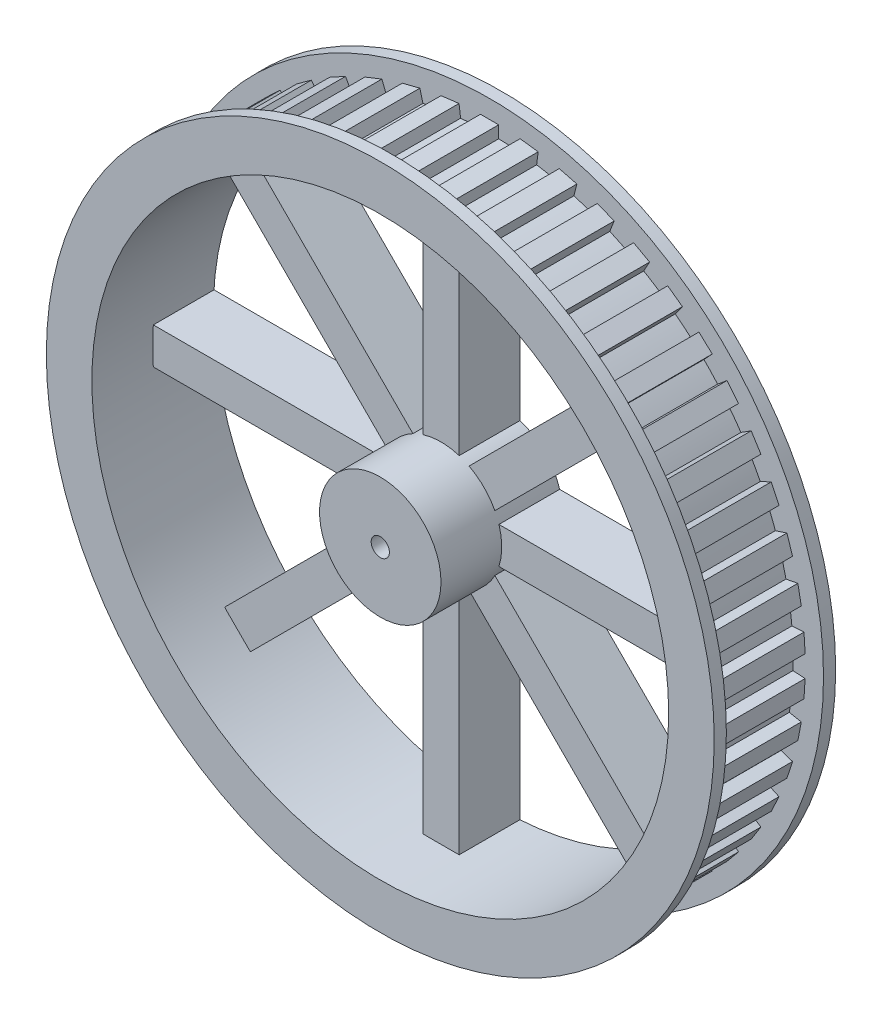
from build123d import *

# Parameters (mm, degrees)
SKETCH1_R               = 10
BOSS_EXTRUDE1_DEPTH     = 20
SKETCH2_R               = 55
SKETCH2_R_2             = 47.5
BOSS_EXTRUDE2_DEPTH     = 2
SKETCH3_R               = 50
SKETCH3_R_2             = 47.5
SKETCH3_W               = 3
SKETCH3_H               = 2
BOSS_EXTRUDE3_DEPTH     = 20
SKETCH4_R               = 55
SKETCH4_R_2             = 47.5
BOSS_EXTRUDE4_DEPTH     = 2
CUT_EXTRUDE2_DEPTH      = 30
CUT_EXTRUDE2_DEPTH_BACK = 81.311892021
SKETCH5_R               = 1.5
SKETCH6_W               = 6
SKETCH6_H               = 37.865776481
BOSS_EXTRUDE6_DEPTH     = 10
CIRPATTERN1_COUNT       = 8


with BuildPart() as part:
    # Sketch1 → Boss-Extrude1 (new body)
    with BuildSketch(Plane.XY):
        Circle(SKETCH1_R)
    extrude(amount=BOSS_EXTRUDE1_DEPTH)

    # Sketch5 → Cut-Extrude2 (cut, two sides: drawn at the far end of the back side and taken through both)
    with BuildSketch(Plane.XY.offset(-CUT_EXTRUDE2_DEPTH_BACK)):
        Circle(SKETCH5_R)
    extrude(amount=CUT_EXTRUDE2_DEPTH + CUT_EXTRUDE2_DEPTH_BACK, mode=Mode.SUBTRACT)

    # Sketch6 → Boss-Extrude6 (add)
    with BuildSketch(Plane.XY):
        with Locations((0, 28.472280255)):
            Rectangle(SKETCH6_W, SKETCH6_H)
    boss_extrude6 = extrude(amount=BOSS_EXTRUDE6_DEPTH)

    # CirPattern1: Boss-Extrude6 ×8 about axis
    cirpattern1_axis = Axis((0, 0, 0), (0, 0, 1))
    for i in range(1, CIRPATTERN1_COUNT):
        add(boss_extrude6.rotate(cirpattern1_axis, i * 360 / CIRPATTERN1_COUNT))


with BuildPart() as body_2:
    # Sketch2 → Boss-Extrude2 (new body)
    with BuildSketch(Plane.XY):
        Circle(SKETCH2_R)
        Circle(SKETCH2_R_2, mode=Mode.SUBTRACT)
    extrude(amount=BOSS_EXTRUDE2_DEPTH)

    # Sketch3 → Boss-Extrude3 (add)
    # profile 1 of 51: a face of its own
    with BuildSketch(Plane.XY):
        Circle(SKETCH3_R)
        Circle(SKETCH3_R_2, mode=Mode.SUBTRACT)
    # profile 2 of 51: a face of its own
    with BuildSketch(Plane.XY):
        with Locations((0, 50.977494935)):
            Rectangle(SKETCH3_W, SKETCH3_H)
    # profile 3 of 51: a face of its own
    with BuildSketch(Plane.XY):
        Polygon((4.775668994, 49.77140731), (5.026335461, 51.755636713), (8.002679565, 51.379637012), (7.752013098, 49.39540761), align=None)
    # profile 4 of 51: a face of its own
    with BuildSketch(Plane.XY):
        Polygon((10.976022835, 48.78039486), (11.473402609, 50.717561183), (14.379152092, 49.971491521), (13.881772318, 48.034325199), align=None)
    # profile 5 of 51: a face of its own
    with BuildSketch(Plane.XY):
        Polygon((17.003278238, 47.020086443), (17.739527344, 48.879639415), (20.528856802, 47.775265757), (19.792607696, 45.915712785), align=None)
    # profile 6 of 51: a face of its own
    with BuildSketch(Plane.XY):
        Polygon((22.762381787, 44.518243175), (23.725889136, 46.270856535), (26.354809176, 44.825595513), (25.391301828, 43.072982152), align=None)
    # profile 7 of 51: a face of its own
    with BuildSketch(Plane.XY):
        Polygon((28.162508978, 41.314320617), (29.338079482, 42.932354606), (31.765130466, 41.168998849), (30.589559961, 39.55096486), align=None)
    # profile 8 of 51: a face of its own
    with BuildSketch(Plane.XY):
        Polygon((33.118496578, 37.458846544), (34.48759079, 38.916783799), (36.674496672, 36.863142481), (35.305402461, 35.405205226), align=None)
    # profile 9 of 51: a face of its own
    with BuildSketch(Plane.XY):
        Polygon((37.552185704, 33.012624083), (39.093212189, 34.287472063), (41.005484159, 31.975932335), (39.464457673, 30.701084355), align=None)
    # profile 10 of 51: a face of its own
    with BuildSketch(Plane.XY):
        Polygon((41.393654428, 28.04577282), (43.082310279, 29.11742641), (44.689790664, 26.584442634), (43.001134813, 25.512789044), align=None)
    # profile 11 of 51: a face of its own
    with BuildSketch(Plane.XY):
        Polygon((44.582320495, 22.636622966), (46.391974599, 23.48818155), (47.669312474, 20.773700392), (45.859658369, 19.922141809), align=None)
    # profile 12 of 51: a face of its own
    with BuildSketch(Plane.XY):
        Polygon((47.067896735, 16.870480046), (48.970009767, 17.488514034), (49.89706075, 14.635344486), (47.994947718, 14.017310497), align=None)
    # profile 13 of 51: a face of its own
    with BuildSketch(Plane.XY):
        Polygon((48.811184126, 10.838279577), (50.775758628, 11.213042206), (51.337902572, 8.266180454), (49.37332807, 7.891417825), align=None)
    # profile 14 of 51: a face of its own
    with BuildSketch(Plane.XY):
        Polygon((49.784689986, 4.635152964), (51.780743443, 4.760734003), (51.969115001, 1.766653818), (49.973061545, 1.641072779), align=None)
    # profile 15 of 51: a face of its own
    with BuildSketch(Plane.XY):
        Polygon((49.973061545, -1.641072779), (51.969115001, -1.766653818), (51.780743443, -4.760734003), (49.784689986, -4.635152964), align=None)
    # profile 16 of 51: a face of its own
    with BuildSketch(Plane.XY):
        Polygon((49.37332807, -7.891417825), (51.337902572, -8.266180454), (50.775758628, -11.213042206), (48.811184126, -10.838279577), align=None)
    # profile 17 of 51: a face of its own
    with BuildSketch(Plane.XY):
        Polygon((47.994947718, -14.017310497), (49.89706075, -14.635344486), (48.970009767, -17.488514034), (47.067896735, -16.870480046), align=None)
    # profile 18 of 51: a face of its own
    with BuildSketch(Plane.XY):
        Polygon((45.859658369, -19.922141809), (47.669312474, -20.773700392), (46.391974599, -23.48818155), (44.582320495, -22.636622966), align=None)
    # profile 19 of 51: a face of its own
    with BuildSketch(Plane.XY):
        Polygon((43.001134813, -25.512789044), (44.689790664, -26.584442634), (43.082310279, -29.11742641), (41.393654428, -28.04577282), align=None)
    # profile 20 of 51: a face of its own
    with BuildSketch(Plane.XY):
        Polygon((39.464457673, -30.701084355), (41.005484159, -31.975932335), (39.093212189, -34.287472063), (37.552185704, -33.012624083), align=None)
    # profile 21 of 51: a face of its own
    with BuildSketch(Plane.XY):
        Polygon((35.305402461, -35.405205226), (36.674496672, -36.863142481), (34.48759079, -38.916783799), (33.118496578, -37.458846544), align=None)
    # profile 22 of 51: a face of its own
    with BuildSketch(Plane.XY):
        Polygon((30.589559961, -39.55096486), (31.765130466, -41.168998849), (29.338079482, -42.932354606), (28.162508978, -41.314320617), align=None)
    # profile 23 of 51: a face of its own
    with BuildSketch(Plane.XY):
        Polygon((25.391301828, -43.072982152), (26.354809176, -44.825595513), (23.725889136, -46.270856535), (22.762381787, -44.518243175), align=None)
    # profile 24 of 51: a face of its own
    with BuildSketch(Plane.XY):
        Polygon((19.792607696, -45.915712785), (20.528856802, -47.775265757), (17.739527344, -48.879639415), (17.003278238, -47.020086443), align=None)
    # profile 25 of 51: a face of its own
    with BuildSketch(Plane.XY):
        Polygon((13.881772318, -48.034325199), (14.379152092, -49.971491521), (11.473402609, -50.717561183), (10.976022835, -48.78039486), align=None)
    # profile 26 of 51: a face of its own
    with BuildSketch(Plane.XY):
        Polygon((7.752013098, -49.39540761), (8.002679565, -51.379637012), (5.026335461, -51.755636713), (4.775668994, -49.77140731), align=None)
    # profile 27 of 51: a face of its own
    with BuildSketch(Plane.XY):
        with Locations((0, -50.977494935)):
            Rectangle(SKETCH3_W, SKETCH3_H)
    # profile 28 of 51: a face of its own
    with BuildSketch(Plane.XY):
        Polygon((-4.775668994, -49.77140731), (-5.026335461, -51.755636713), (-8.002679565, -51.379637012), (-7.752013098, -49.39540761), align=None)
    # profile 29 of 51: a face of its own
    with BuildSketch(Plane.XY):
        Polygon((-10.976022835, -48.78039486), (-11.473402609, -50.717561183), (-14.379152092, -49.971491521), (-13.881772318, -48.034325199), align=None)
    # profile 30 of 51: a face of its own
    with BuildSketch(Plane.XY):
        Polygon((-17.003278238, -47.020086443), (-17.739527344, -48.879639415), (-20.528856802, -47.775265757), (-19.792607696, -45.915712785), align=None)
    # profile 31 of 51: a face of its own
    with BuildSketch(Plane.XY):
        Polygon((-22.762381787, -44.518243175), (-23.725889136, -46.270856535), (-26.354809176, -44.825595513), (-25.391301828, -43.072982152), align=None)
    # profile 32 of 51: a face of its own
    with BuildSketch(Plane.XY):
        Polygon((-28.162508978, -41.314320617), (-29.338079482, -42.932354606), (-31.765130466, -41.168998849), (-30.589559961, -39.55096486), align=None)
    # profile 33 of 51: a face of its own
    with BuildSketch(Plane.XY):
        Polygon((-33.118496578, -37.458846544), (-34.48759079, -38.916783799), (-36.674496672, -36.863142481), (-35.305402461, -35.405205226), align=None)
    # profile 34 of 51: a face of its own
    with BuildSketch(Plane.XY):
        Polygon((-37.552185704, -33.012624083), (-39.093212189, -34.287472063), (-41.005484159, -31.975932335), (-39.464457673, -30.701084355), align=None)
    # profile 35 of 51: a face of its own
    with BuildSketch(Plane.XY):
        Polygon((-41.393654428, -28.04577282), (-43.082310279, -29.11742641), (-44.689790664, -26.584442634), (-43.001134813, -25.512789044), align=None)
    # profile 36 of 51: a face of its own
    with BuildSketch(Plane.XY):
        Polygon((-44.582320495, -22.636622966), (-46.391974599, -23.48818155), (-47.669312474, -20.773700392), (-45.859658369, -19.922141809), align=None)
    # profile 37 of 51: a face of its own
    with BuildSketch(Plane.XY):
        Polygon((-47.067896735, -16.870480046), (-48.970009767, -17.488514034), (-49.89706075, -14.635344486), (-47.994947718, -14.017310497), align=None)
    # profile 38 of 51: a face of its own
    with BuildSketch(Plane.XY):
        Polygon((-48.811184126, -10.838279577), (-50.775758628, -11.213042206), (-51.337902572, -8.266180454), (-49.37332807, -7.891417825), align=None)
    # profile 39 of 51: a face of its own
    with BuildSketch(Plane.XY):
        Polygon((-49.784689986, -4.635152964), (-51.780743443, -4.760734003), (-51.969115001, -1.766653818), (-49.973061545, -1.641072779), align=None)
    # profile 40 of 51: a face of its own
    with BuildSketch(Plane.XY):
        Polygon((-49.973061545, 1.641072779), (-51.969115001, 1.766653818), (-51.780743443, 4.760734003), (-49.784689986, 4.635152964), align=None)
    # profile 41 of 51: a face of its own
    with BuildSketch(Plane.XY):
        Polygon((-49.37332807, 7.891417825), (-51.337902572, 8.266180454), (-50.775758628, 11.213042206), (-48.811184126, 10.838279577), align=None)
    # profile 42 of 51: a face of its own
    with BuildSketch(Plane.XY):
        Polygon((-47.994947718, 14.017310497), (-49.89706075, 14.635344486), (-48.970009767, 17.488514034), (-47.067896735, 16.870480046), align=None)
    # profile 43 of 51: a face of its own
    with BuildSketch(Plane.XY):
        Polygon((-45.859658369, 19.922141809), (-47.669312474, 20.773700392), (-46.391974599, 23.48818155), (-44.582320495, 22.636622966), align=None)
    # profile 44 of 51: a face of its own
    with BuildSketch(Plane.XY):
        Polygon((-43.001134813, 25.512789044), (-44.689790664, 26.584442634), (-43.082310279, 29.11742641), (-41.393654428, 28.04577282), align=None)
    # profile 45 of 51: a face of its own
    with BuildSketch(Plane.XY):
        Polygon((-39.464457673, 30.701084355), (-41.005484159, 31.975932335), (-39.093212189, 34.287472063), (-37.552185704, 33.012624083), align=None)
    # profile 46 of 51: a face of its own
    with BuildSketch(Plane.XY):
        Polygon((-35.305402461, 35.405205226), (-36.674496672, 36.863142481), (-34.48759079, 38.916783799), (-33.118496578, 37.458846544), align=None)
    # profile 47 of 51: a face of its own
    with BuildSketch(Plane.XY):
        Polygon((-30.589559961, 39.55096486), (-31.765130466, 41.168998849), (-29.338079482, 42.932354606), (-28.162508978, 41.314320617), align=None)
    # profile 48 of 51: a face of its own
    with BuildSketch(Plane.XY):
        Polygon((-25.391301828, 43.072982152), (-26.354809176, 44.825595513), (-23.725889136, 46.270856535), (-22.762381787, 44.518243175), align=None)
    # profile 49 of 51: a face of its own
    with BuildSketch(Plane.XY):
        Polygon((-19.792607696, 45.915712785), (-20.528856802, 47.775265757), (-17.739527344, 48.879639415), (-17.003278238, 47.020086443), align=None)
    # profile 50 of 51: a face of its own
    with BuildSketch(Plane.XY):
        Polygon((-13.881772318, 48.034325199), (-14.379152092, 49.971491521), (-11.473402609, 50.717561183), (-10.976022835, 48.78039486), align=None)
    # profile 51 of 51: a face of its own
    with BuildSketch(Plane.XY):
        Polygon((-7.752013098, 49.39540761), (-8.002679565, 51.379637012), (-5.026335461, 51.755636713), (-4.775668994, 49.77140731), align=None)
    extrude(amount=BOSS_EXTRUDE3_DEPTH)

    # Sketch4 → Boss-Extrude4 (add)
    with BuildSketch(Plane.XY.offset(20)):
        Circle(SKETCH4_R)
        Circle(SKETCH4_R_2, mode=Mode.SUBTRACT)
    extrude(amount=-BOSS_EXTRUDE4_DEPTH)


solid = Compound([part.part, body_2.part])
